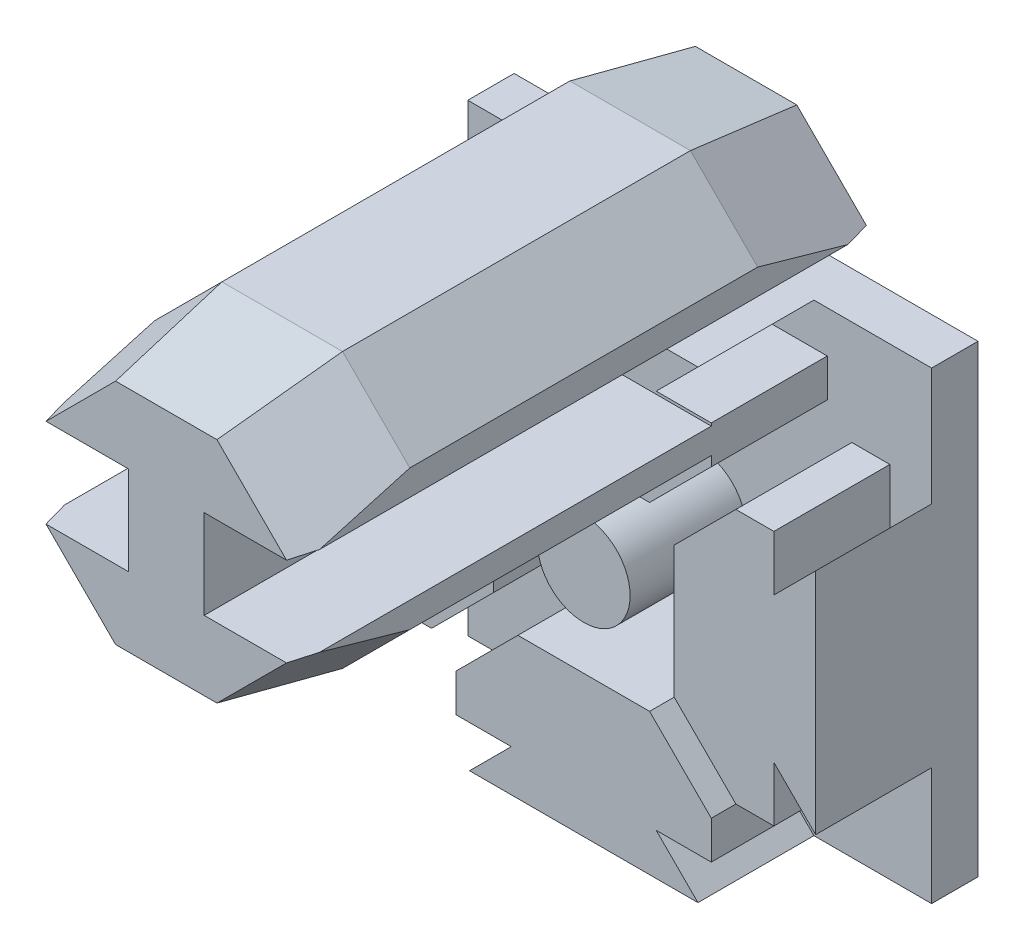
from build123d import *
from OCP.BRepFilletAPI import BRepFilletAPI_MakeChamfer

# Parameters (mm, degrees)
BOSS_EXTRUDE1_DEPTH   = 5
BOSS_EXTRUDE1_2_DEPTH = 5
BOSS_EXTRUDE1_3_DEPTH = 5
BOSS_EXTRUDE1_4_DEPTH = 5
SKETCH1_R             = 2
BOSS_EXTRUDE1_5_DEPTH = 5
SKETCH1_3_W           = 20
SKETCH1_3_H           = 20
BOSS_EXTRUDE2_DEPTH   = 2
BOSS_EXTRUDE3_DEPTH   = 7
BOSS_EXTRUDE4_DEPTH   = 18
CHAMFER1_SIZE         = 1
CHAMFER1_SIZE2        = 5
CHAMFER2_SIZE         = 5
CHAMFER2_SIZE2        = 1
CHAMFER3_SIZE         = 1
CHAMFER3_SIZE2        = 5


with BuildPart() as part:
    # Sketch1 → Boss-Extrude1 (new body)
    with BuildSketch(Plane.XY):
        Polygon((4.925, 10), (-4.925, 10), (-3.125, 8.2), (-5.5, 8.2), (-5.5, 6.560660172), (-2.839339828, 3.9), (2.839339828, 3.9), (5.5, 6.560660172), (5.5, 8.2), (3.125, 8.2), align=None)
    extrude(amount=BOSS_EXTRUDE1_DEPTH)



with BuildPart() as body_2:
    # Sketch1 → Boss-Extrude1 2 (new body)
    with BuildSketch(Plane.XY):
        Polygon((-8.2, 3.125), (-10, 4.925), (-10, -4.925), (-8.2, -3.125), (-8.2, -5.5), (-6.560660172, -5.5), (-3.9, -2.839339828), (-3.9, 2.839339828), (-6.560660172, 5.5), (-8.2, 5.5), align=None)
    extrude(amount=BOSS_EXTRUDE1_2_DEPTH)


with BuildPart() as body_3:
    # Sketch1 → Boss-Extrude1 3 (new body)
    with BuildSketch(Plane.XY):
        Polygon((10, -4.925), (10, 4.925), (8.2, 3.125), (8.2, 5.5), (6.560660172, 5.5), (3.9, 2.839339828), (3.9, -2.839339828), (6.560660172, -5.5), (8.2, -5.5), (8.2, -3.125), align=None)
    extrude(amount=BOSS_EXTRUDE1_3_DEPTH)


with BuildPart() as body_4:
    # Sketch1 → Boss-Extrude1 4 (new body)
    with BuildSketch(Plane.XY):
        Polygon((-3.125, -8.2), (-4.925, -10), (4.925, -10), (3.125, -8.2), (5.5, -8.2), (5.5, -6.560660172), (2.839339828, -3.9), (-2.839339828, -3.9), (-5.5, -6.560660172), (-5.5, -8.2), align=None)
    extrude(amount=BOSS_EXTRUDE1_4_DEPTH)


with BuildPart() as body_5:
    # Sketch1 → Boss-Extrude1 5 (new body)
    with BuildSketch(Plane.XY):
        Circle(SKETCH1_R)
    extrude(amount=BOSS_EXTRUDE1_5_DEPTH)


with BuildPart() as part_1:
    add(part.part)

    add(body_2.part)  # Boss-Extrude2 merges body 2

    add(body_3.part)  # Boss-Extrude2 merges body 3

    add(body_4.part)  # Boss-Extrude2 merges body 4

    add(body_5.part)  # Boss-Extrude2 merges body 5
    # Sketch1<3> → Boss-Extrude2 (add)
    with BuildSketch(Plane.XY):
        Rectangle(SKETCH1_3_W, SKETCH1_3_H)
    extrude(amount=-BOSS_EXTRUDE2_DEPTH)

    # Sketch2 → Boss-Extrude3 (add)
    with BuildSketch(Plane.XY.offset(5)):
        Polygon((-1.635636459, 11.91873161), (-1.635636459, 10), (1.635636459, 10), (1.635636459, 11.91873161), (5.5, 11.91873161), (5.5, 13.01873161), (2.6, 15.91873161), (-2.6, 15.91873161), (-5.5, 13.01873161), (-5.5, 11.91873161), align=None)
    extrude(amount=-BOSS_EXTRUDE3_DEPTH)

    # Sketch2<4> → Boss-Extrude4 (add)
    with BuildSketch(Plane.XY.offset(5)):
        Polygon((-5.5, 8.08126839), (-5.5, 6.98126839), (-2.6, 4.08126839), (2.6, 4.08126839), (5.5, 6.98126839), (5.5, 8.08126839), (1.635636459, 8.08126839), (1.635636459, 11.91873161), (5.5, 11.91873161), (5.5, 13.01873161), (2.6, 15.91873161), (-2.6, 15.91873161), (-5.5, 13.01873161), (-5.5, 11.91873161), (-1.635636459, 11.91873161), (-1.635636459, 8.08126839), align=None)
    extrude(amount=BOSS_EXTRUDE4_DEPTH)

    # Chamfer1
    chamfer1_edges = [part_1.edges().sort_by_distance(p)[0] for p in [
        (4.05, 14.46873161, 23),
        (0, 15.91873161, 23),
        (-4.05, 14.46873161, 23),
    ]]
    chamfer1_side = [part_1.faces().sort_by_distance(p)[0] for p in [
        (0, 10, 23),
    ]]
    chamfer(chamfer1_edges, length=CHAMFER1_SIZE, length2=CHAMFER1_SIZE2, reference=chamfer1_side[0])

    # Chamfer2: one chamfer whose edges measure the first distance from different faces: ONE call of the kernel's chamfer builder (chamfer() names one face for all edges)
    chamfer2_edges_1 = [part_1.edges().sort_by_distance(p)[0] for p in [
        (4.05, 14.46873161, -2),
    ]]
    chamfer2_side_1 = [part_1.faces().sort_by_distance(p)[0] for p in [
        (4.05, 14.46873161, 8),
    ]]
    chamfer2_edges_2 = [part_1.edges().sort_by_distance(p)[0] for p in [
        (0, 15.91873161, -2),
    ]]
    chamfer2_side_2 = [part_1.faces().sort_by_distance(p)[0] for p in [
        (0, 15.91873161, 8),
    ]]
    chamfer2_edges_3 = [part_1.edges().sort_by_distance(p)[0] for p in [
        (-4.05, 14.46873161, -2),
    ]]
    chamfer2_side_3 = [part_1.faces().sort_by_distance(p)[0] for p in [
        (-4.05, 14.46873161, 8),
    ]]
    chamfer2 = BRepFilletAPI_MakeChamfer(part_1.part.solid().wrapped)
    for e in chamfer2_edges_1:
        chamfer2.Add(CHAMFER2_SIZE, CHAMFER2_SIZE2, e.wrapped, chamfer2_side_1[0].wrapped)  # the first distance lies on this face
    for e in chamfer2_edges_2:
        chamfer2.Add(CHAMFER2_SIZE, CHAMFER2_SIZE2, e.wrapped, chamfer2_side_2[0].wrapped)  # the first distance lies on this face
    for e in chamfer2_edges_3:
        chamfer2.Add(CHAMFER2_SIZE, CHAMFER2_SIZE2, e.wrapped, chamfer2_side_3[0].wrapped)  # the first distance lies on this face
    add(Compound.cast(chamfer2.Shape()), mode=Mode.REPLACE)

    # Chamfer3
    chamfer3_edges = [part_1.edges().sort_by_distance(p)[0] for p in [
        (4.05, 5.53126839, 23),
        (0, 4.08126839, 23),
        (-4.05, 5.53126839, 23),
    ]]
    chamfer3_side = [part_1.faces().sort_by_distance(p)[0] for p in [
        (0, 9.15065978, 23),
    ]]
    chamfer(chamfer3_edges, length=CHAMFER3_SIZE, length2=CHAMFER3_SIZE2, reference=chamfer3_side[0])


solid = part_1.part
